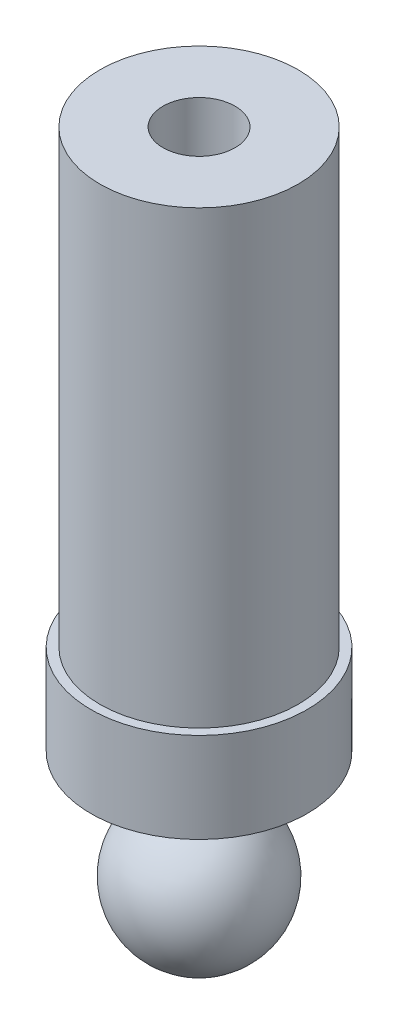
from build123d import *

# Parameters (mm, degrees)
SKETCH1_R           = 6
BOSS_EXTRUDE1_DEPTH = 45
SKETCH7_W           = 15
SKETCH7_H           = 15
CUT_EXTRUDE5_DEPTH  = 25
SKETCH4_R           = 6
SKETCH4_R_2         = 5.5
CUT_EXTRUDE6_DEPTH  = 38
SKETCH5_R           = 2
CUT_EXTRUDE7_DEPTH  = 56
SKETCH8_R           = 2
BOSS_EXTRUDE2_DEPTH = 3


with BuildPart() as part:
    # Sketch1 → Boss-Extrude1 (new body)
    with BuildSketch(Plane(origin=(0, 0, 0), x_dir=(1, 0, 0), z_dir=(0, 1, 0))):
        with Locations(Location((0, 0, 0), (0, 0, 90))):
            Circle(SKETCH1_R)
    extrude(amount=BOSS_EXTRUDE1_DEPTH)

    # Sketch7 → Cut-Extrude5 (cut)
    with BuildSketch(Plane(origin=(0, 30, 0), x_dir=(1, 0, 0), z_dir=(0, 1, 0))):
        Rectangle(SKETCH7_W, SKETCH7_H)
    extrude(amount=CUT_EXTRUDE5_DEPTH, mode=Mode.SUBTRACT)

    # Sketch4 → Cut-Extrude6 (cut)
    with BuildSketch(Plane(origin=(0, 5, 0), x_dir=(1, 0, 0), z_dir=(0, 1, 0))):
        with Locations(Location((0, 0, 0), (0, 0, 90))):
            Circle(SKETCH4_R)
        with Locations(Location((0, 0, 0), (0, 0, 270))):
            Circle(SKETCH4_R_2, mode=Mode.SUBTRACT)
    extrude(amount=CUT_EXTRUDE6_DEPTH, mode=Mode.SUBTRACT)

    # Sketch5 → Cut-Extrude7 (cut)
    with BuildSketch(Plane(origin=(0, 45, 0), x_dir=(1, 0, 0), z_dir=(0, 1, 0))):
        with Locations(Location((0, 0, 0), (0, 0, 270))):
            Circle(SKETCH5_R)
    extrude(amount=-CUT_EXTRUDE7_DEPTH, mode=Mode.SUBTRACT)


with BuildPart() as body_2:
    # Sketch8 → Boss-Extrude2 (new body)
    with BuildSketch(Plane.XZ):
        with Locations(Location((0, 0, 0), (0, 0, 270))):
            Circle(SKETCH8_R)
    extrude(amount=BOSS_EXTRUDE2_DEPTH)

    # Sketch9 → Revolve2 (revolve)
    with BuildSketch(Plane(origin=(0, -6, 0), x_dir=(1, 0, 0), z_dir=(0, 1, 0))):
        with BuildLine():
            Line((-4, 0), (4, 0))
            ThreePointArc((4, 0), (0, 4), (-4, 0))
        make_face()
    revolve(axis=Axis((-4, -6, 0), (1, 0, 0)))


solid = Compound([part.part, body_2.part])
